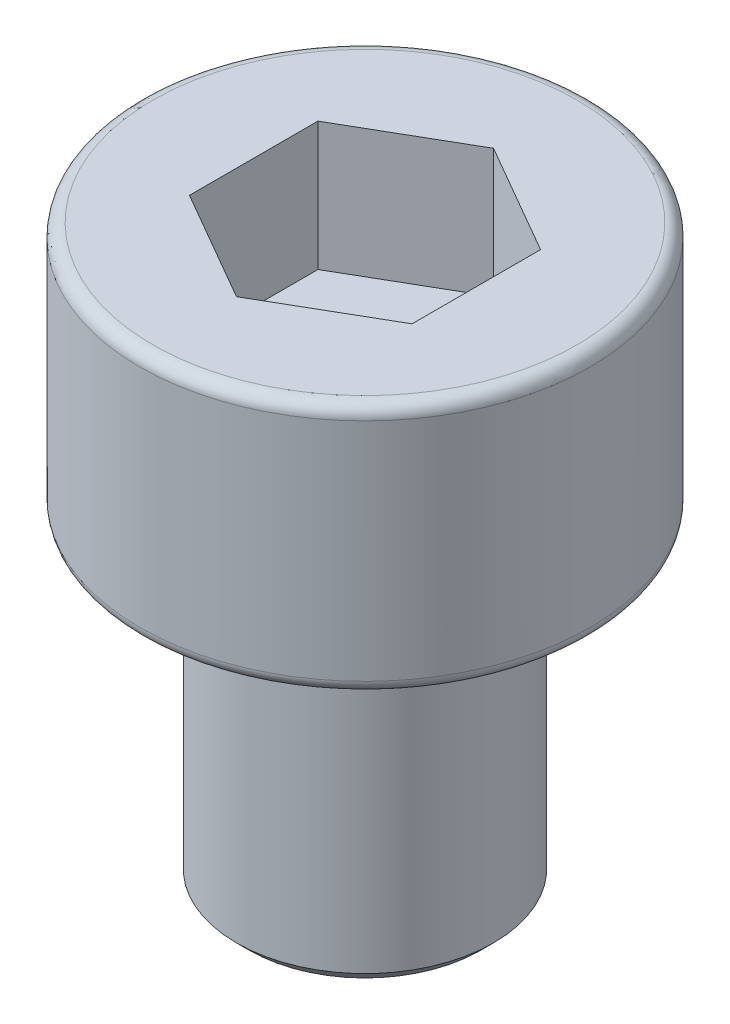
from build123d import *

# Parameters (mm, degrees)
CUT_EXTRUDE_1_DEPTH = 2
FILLET_1_R          = 0.2
CHAMFER_1_SIZE      = 0.2


with BuildPart() as part:
    # 草图1 → 旋转1 (revolve)
    with BuildSketch(Plane.XY, mode=Mode.PRIVATE) as revolve_1_sk:
        Polygon((0, 0), (3.5, 0), (3.5, -3.91), (2, -3.91), (2, -8.91), (0, -8.91), align=None)
    revolve(revolve_1_sk.sketch.rotate(Axis((0, 0, 0), (0, -1, 0)), 90), axis=Axis((0, 0, 0), (0, -1, 0)))

    # 草图2 → 切除-拉伸1 (cut)
    with BuildSketch(Plane(origin=(0, 0, 0), x_dir=(1, 0, 0), z_dir=(0, 1, 0))):
        Polygon((0, 2), (-1.732050808, 1), (-1.732050808, -1), (0, -2), (1.732050808, -1), (1.732050808, 1), align=None)
    extrude(amount=-CUT_EXTRUDE_1_DEPTH, mode=Mode.SUBTRACT)

    # 圆角1
    fillet_1_edges = [part.edges().sort_by_distance(p)[0] for p in [
        (0, -3.91, -3.5),
        (0, 0, -3.5),
    ]]
    fillet(fillet_1_edges, radius=FILLET_1_R)

    # 倒角1
    chamfer_1_edges = [part.edges().sort_by_distance(p)[0] for p in [
        (0, -8.91, -2),
    ]]
    chamfer(chamfer_1_edges, length=CHAMFER_1_SIZE)


solid = part.part
